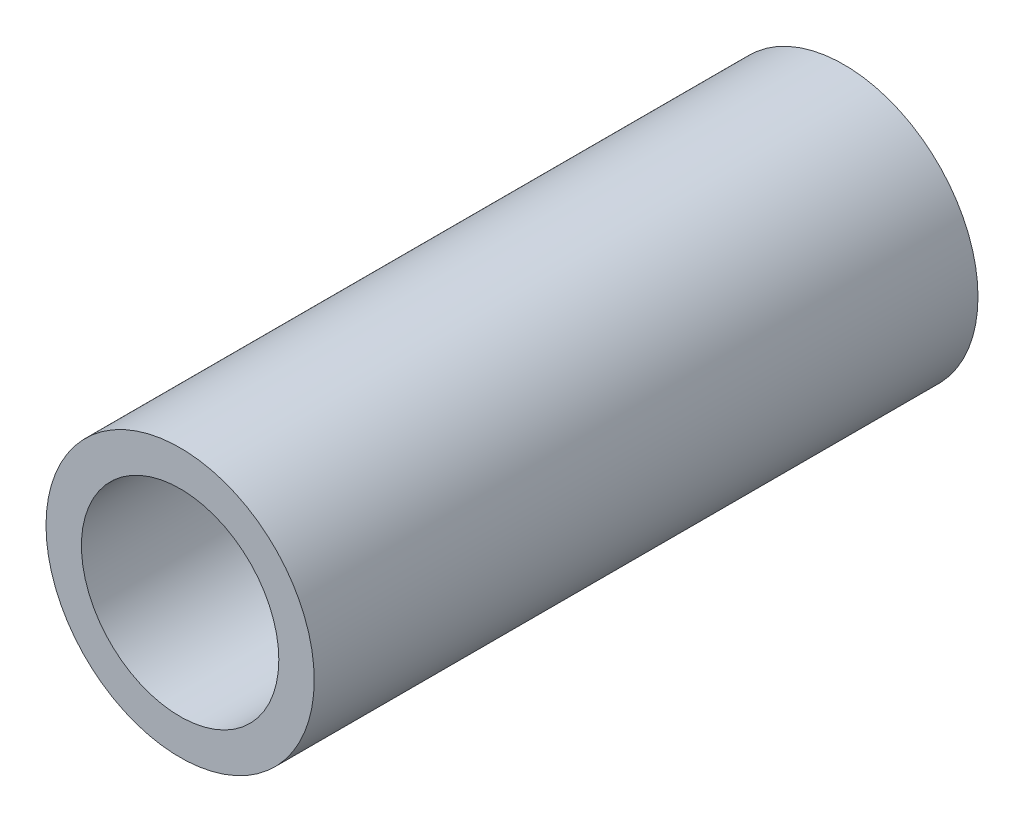
from build123d import *

# Parameters (mm, degrees)
SKETCH1_R           = 5.55625
SKETCH1_R_2         = 4.0894
BOSS_EXTRUDE1_DEPTH = 27.5


with BuildPart() as part:
    # Sketch1 → Boss-Extrude1 (new body)
    with BuildSketch(Plane.XY):
        Circle(SKETCH1_R)
        Circle(SKETCH1_R_2, mode=Mode.SUBTRACT)
    extrude(amount=BOSS_EXTRUDE1_DEPTH)


solid = part.part
